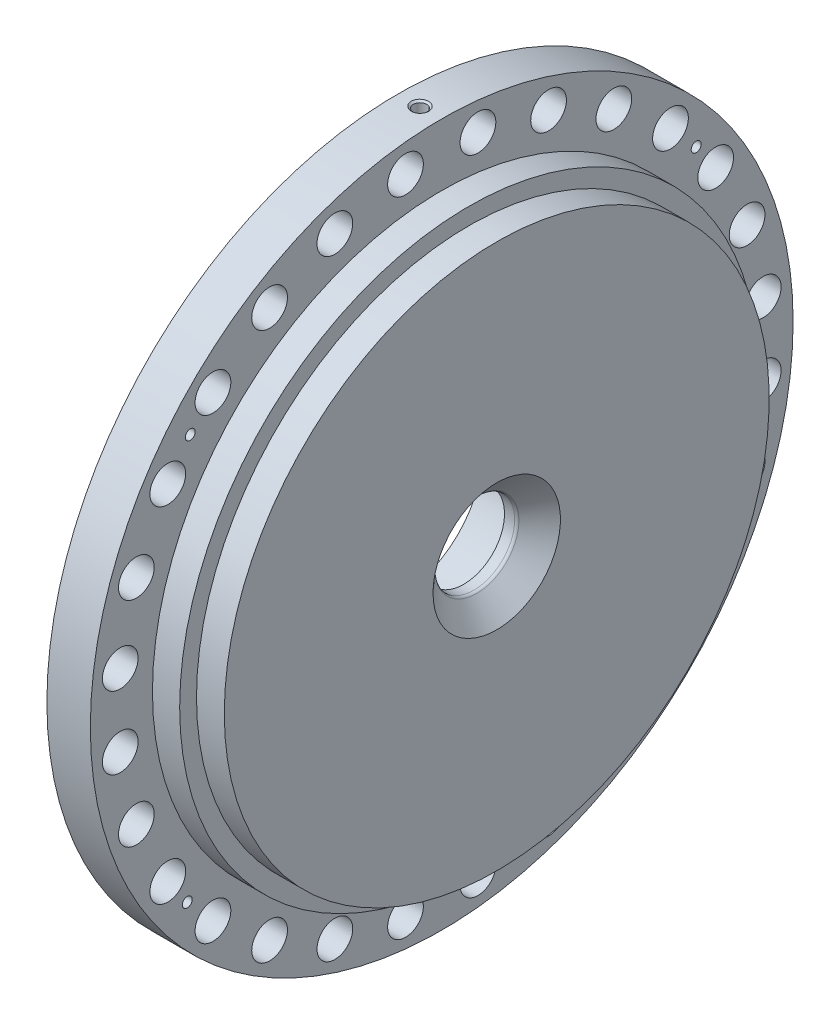
from build123d import *

# Parameters (mm, degrees)
SKETCH4_R                         = 14.2875
CUT_EXTRUDE1_DEPTH                = 406.190469782
CIRPATTERN2_COUNT                 = 28
CIRPATTERN3_COUNT                 = 12
CIRPATTERN4_COUNT                 = 4
CIRPATTERN5_COUNT                 = 56
F_1_2_13_TAPPED_HOLE4_D           = 10.71626
F_1_2_13_TAPPED_HOLE4_DEPTH       = 35.052
F_1_2_13_TAPPED_HOLE4_CSINK_D     = 13.97
F_1_2_13_TAPPED_HOLE4_CSINK_ANGLE = 100
F_1_2_13_TAPPED_HOLE4_TIP         = 3.219489309


with BuildPart() as part:
    # Sketch1 → Revolve1 (revolve)
    with BuildSketch(Plane.XY, mode=Mode.PRIVATE) as revolve1_sk:
        with BuildLine():
            Line((-5.9944, 67.7545), (-5.9944, 180.9496))
            Line((-5.9944, 180.9496), (0, 180.9496))
            Line((0, 180.9496), (0, 228.9937))
            Line((0, 228.9937), (-5.9944, 228.9937))
            Line((-5.9944, 228.9937), (-5.9944, 281.051))
            Line((-5.9944, 281.051), (28.7528, 281.051))
            Line((28.7528, 281.051), (28.7528, 231.3686))
            Line((28.7528, 231.3686), (50.5206, 231.3686))
            Line((50.5206, 231.3686), (50.5206, 217.9066))
            Line((50.5206, 217.9066), (72.7456, 217.9066))
            Line((72.7456, 217.9066), (72.7456, 50.9524))
            Line((72.7456, 50.9524), (56.874887948, 33.595307061))
            ThreePointArc((56.874887948, 33.595307061), (55.812013915, 32.832370593), (54.53173857, 32.5628))
            Line((54.53173857, 32.5628), (46.4058, 32.5628))
            Line((46.4058, 32.5628), (46.4058, 67.7545))
            Line((46.4058, 67.7545), (-5.9944, 67.7545))
        make_face()
    revolve(revolve1_sk.sketch.rotate(Axis((0, 0, 0), (1, 0, 0)), 90), axis=Axis((0, 0, 0), (1, 0, 0)))

    # Sketch4 → Cut-Extrude1 (cut, through all)
    with BuildSketch(Plane.ZY.offset(5.9944)):
        with Locations((28.972111579, 257.135466548)):
            Circle(SKETCH4_R)
    cut_extrude1 = extrude(amount=-CUT_EXTRUDE1_DEPTH, mode=Mode.SUBTRACT)

    # CirPattern2: Cut-Extrude1 ×28 about axis
    cirpattern2_axis = Axis((0, 0, 0), (1, 0, 0))
    for i in range(1, CIRPATTERN2_COUNT):
        add(cut_extrude1.rotate(cirpattern2_axis, i * 360 / CIRPATTERN2_COUNT), mode=Mode.SUBTRACT)

    # Sketch8 → 3/4-10 Tapped Hole1 (revolve, cut)
    with BuildSketch(Plane(origin=(0, 199.3429424, 53.413780433), x_dir=(0, 0, 1), z_dir=(0, 1, 0))):
        Polygon((0, 0), (0, 30.407416175), (8.33374, 25.4), (8.33374, 1.82626), (10.16, 0), align=None)
    f_3_4_10_tapped_hole1 = revolve(axis=Axis((-6.35, 199.3429424, 53.413780433), (1, 0, 0)), mode=Mode.SUBTRACT)

    # CirPattern3: 3/4-10 Tapped Hole1 ×12 about axis
    cirpattern3_axis = Axis((0, 0, 0), (1, 0, 0))
    for i in range(1, CIRPATTERN3_COUNT):
        add(f_3_4_10_tapped_hole1.rotate(cirpattern3_axis, i * 360 / CIRPATTERN3_COUNT), mode=Mode.SUBTRACT)

    # Sketch10 → 7/8-9 Tapped Hole1 (revolve, cut)
    with BuildSketch(Plane(origin=(-5.9944, 67.172315786, 67.172315786), x_dir=(0, 0, 1), z_dir=(0, 1, 0))):
        Polygon((0, 0), (0, 31.242239902), (9.72312, 25.4), (9.72312, 2.02438), (11.7475, 0), align=None)
    f_7_8_9_tapped_hole1 = revolve(axis=Axis((-12.3444, 67.172315786, 67.172315786), (1, 0, 0)), mode=Mode.SUBTRACT)

    # CirPattern4: 7/8-9 Tapped Hole1 ×4 about axis
    cirpattern4_axis = Axis((0, 0, 0), (1, 0, 0))
    for i in range(1, CIRPATTERN4_COUNT):
        add(f_7_8_9_tapped_hole1.rotate(cirpattern4_axis, i * 360 / CIRPATTERN4_COUNT), mode=Mode.SUBTRACT)

    # Sketch21 → Tap Drill for 3/8-16 Tap1 (revolve, cut)
    with BuildSketch(Plane(origin=(-5.9944, 162.844517689, 201.096231852), x_dir=(0, 0, 1), z_dir=(0, 1, 0))):
        Polygon((0, 0), (0, 43.024665582), (3.96875, 40.64), (3.96875, 0.635), (4.60375, 0), align=None)
    tap_drill_for_3_8_16_tap1 = revolve(axis=Axis((-12.3444, 162.844517689, 201.096231852), (1, 0, 0)), mode=Mode.SUBTRACT)

    # CirPattern5: Tap Drill for 3/8-16 Tap1 ×56 about axis, 52 skipped
    cirpattern5_axis = Axis((0, 0, 0), (-1, 0, 0))
    add([tap_drill_for_3_8_16_tap1.rotate(cirpattern5_axis, i * 360 / CIRPATTERN5_COUNT) for i in range(1, CIRPATTERN5_COUNT) if i not in (1, 2, 3, 4, 5, 6, 7, 8, 9, 10, 11, 12, 13, 14, 15, 17, 18, 19, 20, 21, 22, 23, 24, 25, 26, 27, 29, 30, 31, 32, 33, 34, 35, 36, 37, 38, 39, 40, 41, 42, 43, 45, 46, 47, 48, 49, 50, 51, 52, 53, 54, 55)], mode=Mode.SUBTRACT)

    # 1/2-13 Tapped Hole4
    with Locations(Plane(origin=(11.3792, 281.051, 0), x_dir=(0, 0, 1), z_dir=(0, 1, 0))):
        with Locations((0, 0)):
            CounterSinkHole(F_1_2_13_TAPPED_HOLE4_D / 2, F_1_2_13_TAPPED_HOLE4_CSINK_D / 2, depth=F_1_2_13_TAPPED_HOLE4_DEPTH, counter_sink_angle=F_1_2_13_TAPPED_HOLE4_CSINK_ANGLE)
            with Locations((0, 0, -(F_1_2_13_TAPPED_HOLE4_DEPTH + F_1_2_13_TAPPED_HOLE4_TIP / 2))):  # 118° drill point
                Cone(0, F_1_2_13_TAPPED_HOLE4_D / 2, F_1_2_13_TAPPED_HOLE4_TIP, mode=Mode.SUBTRACT)


solid = part.part
